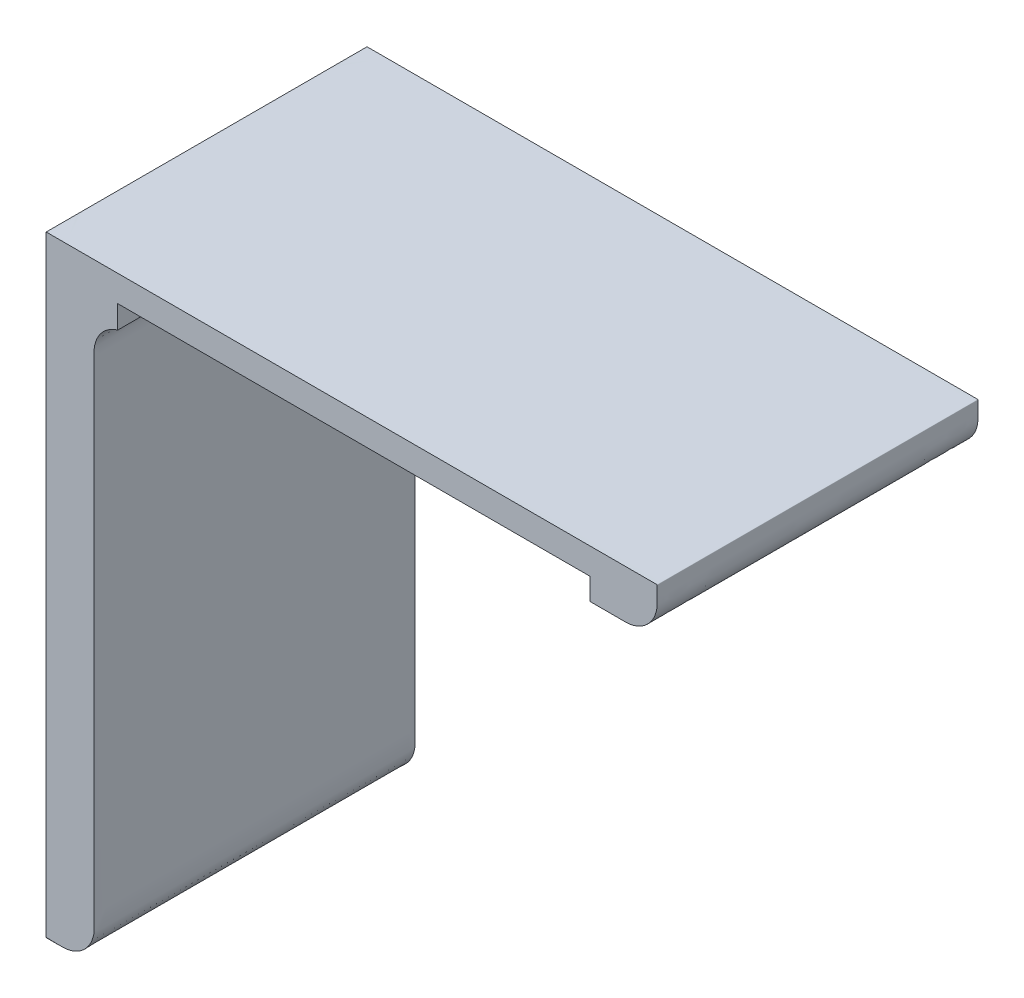
from build123d import *

# Parameters (mm, degrees)
SALIENTE_EXTRUIR1_DEPTH = 20
CROQUIS2_W              = 29.449990942
CROQUIS2_H              = 34.535088102
CORTAR_EXTRUIR1_DEPTH   = 43


with BuildPart() as part:
    # Croquis1 → Saliente-Extruir1 (new body)
    with BuildSketch(Plane.XY):
        with BuildLine():
            add(Edge.make_bspline(
                [(18.90597877, 18.15597877), (18.90597877, 18.39781015), (18.90597877, 18.639641529), (18.90597877, 18.881472908), (18.90597877, 18.885323633), (18.90597877, 18.893025082), (18.893025082, 18.90597877), (18.885323633, 18.90597877), (18.881472908, 18.90597877), (6.19781015, 18.90597877), (-6.485852609, 18.90597877), (-19.169515367, 18.90597877), (-19.173366092, 18.90597877), (-19.181067541, 18.90597877), (-19.19402123, 18.893025082), (-19.19402123, 18.885323633), (-19.19402123, 18.881472908), (-19.19402123, 6.19781015), (-19.19402123, -6.485852609), (-19.19402123, -19.169515367), (-19.19402123, -19.173366092), (-19.19402123, -19.181067541), (-19.181067541, -19.19402123), (-19.173366092, -19.19402123), (-19.169515367, -19.19402123), (-18.927683988, -19.19402123), (-18.685852609, -19.19402123), (-18.44402123, -19.19402123), (-18.416243452, -19.19402123), (-18.360687896, -19.19402123), (-18.277354563, -19.19402123), (-18.221799007, -19.19402123), (-18.19402123, -19.19402123), (-18.166082592, -19.19402123), (-18.110205318, -19.19402123), (-18.026371206, -19.187569961), (-17.97078863, -19.181720345), (-17.943070799, -19.178214739), (-17.212922647, -19.085869414), (-16.627903647, -18.639330781), (-16.346262165, -17.959388094), (-16.313080905, -17.879281447), (-16.257137074, -17.714752592), (-16.19402123, -17.454141659), (-16.19402123, -17.280728039), (-16.19402123, -17.19402123), (-16.19402123, -17.10731442), (-16.19402123, -16.9339008), (-16.19402123, -16.673780371), (-16.19402123, -16.500366751), (-16.19402123, -16.413659942), (-16.19402123, -6.567234134), (-16.19402123, 3.279191674), (-16.19402123, 13.125617482), (-16.19402123, 13.212324292), (-16.19402123, 13.385737912), (-16.19402123, 13.645858341), (-16.19402123, 13.819271961), (-16.19402123, 13.90597877), (-16.19402123, 13.99268558), (-16.19402123, 14.1660992), (-16.130905386, 14.426710133), (-16.074961554, 14.591238988), (-16.041780295, 14.671345635), (-15.836079453, 15.167951398), (-15.455993857, 15.548036993), (-14.959388094, 15.753737835), (-14.879281447, 15.786919095), (-14.714752592, 15.842862926), (-14.454141659, 15.90597877), (-14.280728039, 15.90597877), (-14.19402123, 15.90597877), (-14.10731442, 15.90597877), (-13.9339008, 15.90597877), (-13.673780371, 15.90597877), (-13.500366751, 15.90597877), (-13.413659942, 15.90597877), (-3.567234134, 15.90597877), (6.279191674, 15.90597877), (16.125617482, 15.90597877), (16.212324292, 15.90597877), (16.385737912, 15.90597877), (16.645858341, 15.90597877), (16.819271961, 15.90597877), (16.90597877, 15.90597877), (16.99268558, 15.90597877), (17.1660992, 15.90597877), (17.426710133, 15.969094614), (17.591238988, 16.025038446), (17.671345635, 16.058219705), (18.351288322, 16.339861188), (18.797826955, 16.924880188), (18.890172279, 17.655028339), (18.893677886, 17.682746171), (18.899527501, 17.738328747), (18.90597877, 17.822162858), (18.90597877, 17.878040133), (18.90597877, 17.90597877), (18.90597877, 17.933756548), (18.90597877, 17.989312104), (18.90597877, 18.072645437), (18.90597877, 18.128200993), (18.90597877, 18.15597877)],
                knots=[0, 0, 0, 0, 0.004851842, 0.004851842, 0.004851842, 0.004929098, 0.005006355, 0.005083612, 0.005083612, 0.005083612, 0.259554824, 0.259554824, 0.259554824, 0.259632081, 0.259709338, 0.259786595, 0.259786595, 0.259786595, 0.514257807, 0.514257807, 0.514257807, 0.514335064, 0.514412321, 0.514489577, 0.514489577, 0.514489577, 0.519341419, 0.519341419, 0.519341419, 0.519898722, 0.520456025, 0.521013328, 0.521013328, 0.521013328, 0.521573859, 0.522134389, 0.52269492, 0.52269492, 0.52269492, 0.536129144, 0.536129144, 0.536129144, 0.537868735, 0.539608326, 0.541347917, 0.541347917, 0.541347917, 0.543087508, 0.544827099, 0.54656669, 0.54656669, 0.54656669, 0.744114667, 0.744114667, 0.744114667, 0.745854258, 0.747593849, 0.74933344, 0.74933344, 0.74933344, 0.751073031, 0.752812622, 0.754552213, 0.754552213, 0.754552213, 0.764789206, 0.764789206, 0.764789206, 0.766528797, 0.768268388, 0.770007979, 0.770007979, 0.770007979, 0.77174757, 0.773487161, 0.775226752, 0.775226752, 0.775226752, 0.972774729, 0.972774729, 0.972774729, 0.97451432, 0.976253911, 0.977993502, 0.977993502, 0.977993502, 0.979733093, 0.981472684, 0.983212276, 0.983212276, 0.983212276, 0.996646499, 0.996646499, 0.996646499, 0.99720703, 0.99776756, 0.998328091, 0.998328091, 0.998328091, 0.998885394, 0.999442697, 1, 1, 1, 1], degree=3, weights=[1, 1, 1, 1, 1, 1, 1, 1, 1, 1, 1, 1, 1, 1, 1, 1, 1, 1, 1, 1, 1, 1, 1, 1, 1, 1, 1, 1, 1, 1, 1, 1, 1, 1, 1, 1, 1, 1, 0.909832919, 0.909832919, 1, 1, 1, 1, 1, 1, 1, 1, 1, 1, 1, 1, 1, 1, 1, 1, 1, 1, 1, 1, 1, 1, 1, 1, 0.949253022, 0.949253022, 1, 1, 1, 1, 1, 1, 1, 1, 1, 1, 1, 1, 1, 1, 1, 1, 1, 1, 1, 1, 1, 1, 1, 1, 0.909832919, 0.909832919, 1, 1, 1, 1, 1, 1, 1, 1, 1, 1, 1]))
        make_face()
    extrude(amount=SALIENTE_EXTRUIR1_DEPTH)

    # Croquis2 → Cortar-Extruir1 (cut)
    with BuildSketch(Plane.XY.offset(20)):
        Rectangle(CROQUIS2_W, CROQUIS2_H)
    extrude(amount=-CORTAR_EXTRUIR1_DEPTH, mode=Mode.SUBTRACT)


solid = part.part
